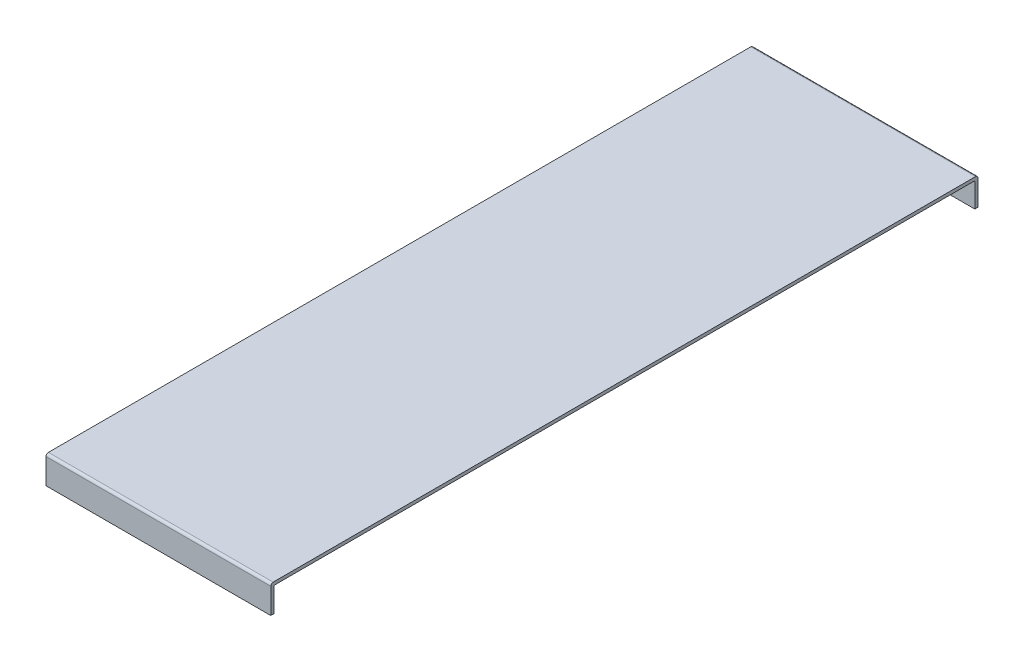
from build123d import *

# Parameters (mm, degrees)
SKETCH1_W           = 139.7
SKETCH1_H           = 439.61
BOSS_EXTRUDE1_DEPTH = 2
SKETCH2_W           = 139.7
SKETCH2_H           = 2
BOSS_EXTRUDE2_DEPTH = 15.24
FILLET1_R           = 1.5
FILLET2_R           = 0.5


with BuildPart() as part:
    # Sketch1 → Boss-Extrude1 (new body)
    with BuildSketch(Plane(origin=(0, 0, 0), x_dir=(1, 0, 0), z_dir=(0, 1, 0))):
        with Locations((-225.481193932, 42.830702244)):
            Rectangle(SKETCH1_W, SKETCH1_H)
    extrude(amount=BOSS_EXTRUDE1_DEPTH)

    # Sketch2 → Boss-Extrude2 (add)
    with BuildSketch(Plane.XZ):
        with Locations((-225.481193932, -261.635702244)):
            Rectangle(SKETCH2_W, SKETCH2_H)
        with Locations((-225.481193932, 175.974297756)):
            Rectangle(SKETCH2_W, SKETCH2_H)
    extrude(amount=BOSS_EXTRUDE2_DEPTH)

    # Fillet1
    fillet1_edges = [part.edges().sort_by_distance(p)[0] for p in [
        (-225.481193932, 2, 176.974297756),
        (-225.481193932, 2, -262.635702244),
    ]]
    fillet(fillet1_edges, radius=FILLET1_R)

    # Fillet2
    fillet2_edges = [part.edges().sort_by_distance(p)[0] for p in [
        (-225.481193932, 0, -260.635702244),
        (-225.481193932, 0, 174.974297756),
    ]]
    fillet(fillet2_edges, radius=FILLET2_R)


solid = part.part
